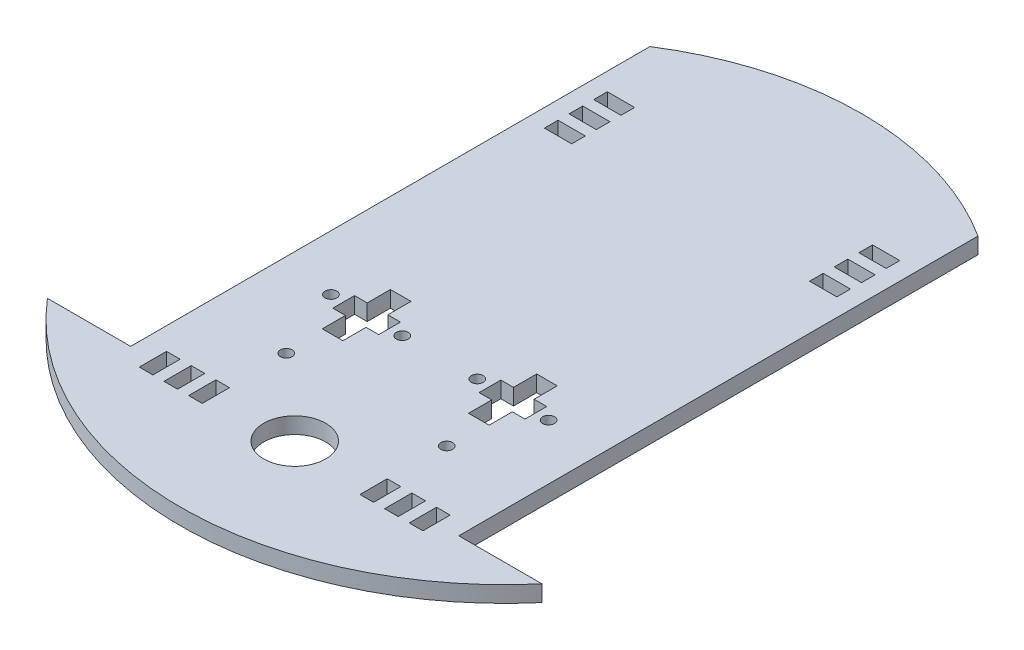
from build123d import *

# Parameters (mm, degrees)
CROQUIS3_R              = 9.54
CROQUIS3_R_2            = 1.825
CROQUIS3_W              = 8.4
CROQUIS3_H              = 4.2
CROQUIS3_W_2            = 4.2
CROQUIS3_H_2            = 8.4
SALIENTE_EXTRUIR1_DEPTH = 5


with BuildPart() as part:
    # Croquis3 → Saliente-Extruir1 (new body)
    with BuildSketch(Plane(origin=(0, 0, 0), x_dir=(1, 0, 0), z_dir=(0, 1, 0))):
        with BuildLine():
            Line((50.5587, 0), (76.2, 0))
            ThreePointArc((76.2, 0), (0, -35.242297755), (-76.2, 0))
            Line((-76.2, 0), (-50.5587, 0))
            Line((-50.5587, 0), (-50.5587, 160))
            ThreePointArc((-50.5587, 160), (0, 174.754698219), (50.5587, 160))
            Line((50.5587, 160), (50.5587, 0))
        make_face()
        with Locations(Location((0, 0, 0), (0, 0, 270))):
            Circle(CROQUIS3_R, mode=Mode.SUBTRACT)
        with Locations(Location((33.5337, 44.7, 0), (0, 0, 270))):
            Circle(CROQUIS3_R_2, mode=Mode.SUBTRACT)
        with Locations(Location((11.5437, 44.7, 0), (0, 0, 90))):
            Circle(CROQUIS3_R_2, mode=Mode.SUBTRACT)
        with Locations(Location((-33.5337, 44.7, 0), (0, 0, 90))):
            Circle(CROQUIS3_R_2, mode=Mode.SUBTRACT)
        with Locations(Location((-11.5437, 44.7, 0), (0, 0, 270))):
            Circle(CROQUIS3_R_2, mode=Mode.SUBTRACT)
        with Locations(Location((24.7337, 22.125, 0), (0, 0, 270))):
            Circle(CROQUIS3_R_2, mode=Mode.SUBTRACT)
        with Locations(Location((-24.7337, 22.125, 0), (0, 0, 90))):
            Circle(CROQUIS3_R_2, mode=Mode.SUBTRACT)
        with Locations((40.8587, 131.7)):
            Rectangle(CROQUIS3_W, CROQUIS3_H, mode=Mode.SUBTRACT)
        with Locations((40.8587, 124.1)):
            Rectangle(CROQUIS3_W, CROQUIS3_H, mode=Mode.SUBTRACT)
        with Locations((40.8587, 139.3)):
            Rectangle(CROQUIS3_W, CROQUIS3_H, mode=Mode.SUBTRACT)
        with Locations((-40.8587, 124.1)):
            Rectangle(CROQUIS3_W, CROQUIS3_H, mode=Mode.SUBTRACT)
        with Locations((-40.8587, 131.7)):
            Rectangle(CROQUIS3_W, CROQUIS3_H, mode=Mode.SUBTRACT)
        with Locations((-40.8587, 139.3)):
            Rectangle(CROQUIS3_W, CROQUIS3_H, mode=Mode.SUBTRACT)
        with Locations((33.9987, 0)):
            Rectangle(CROQUIS3_W_2, CROQUIS3_H_2, mode=Mode.SUBTRACT)
        with Locations((41.5987, 0)):
            Rectangle(CROQUIS3_W_2, CROQUIS3_H_2, mode=Mode.SUBTRACT)
        with Locations((26.3987, 0)):
            Rectangle(CROQUIS3_W_2, CROQUIS3_H_2, mode=Mode.SUBTRACT)
        with Locations((-41.5987, 0)):
            Rectangle(CROQUIS3_W_2, CROQUIS3_H_2, mode=Mode.SUBTRACT)
        with Locations((-33.9987, 0)):
            Rectangle(CROQUIS3_W_2, CROQUIS3_H_2, mode=Mode.SUBTRACT)
        with Locations((-26.3987, 0)):
            Rectangle(CROQUIS3_W_2, CROQUIS3_H_2, mode=Mode.SUBTRACT)
        Polygon((19.3637, 34.2), (19.3637, 41.35), (15.4687, 41.35), (15.4687, 48.05), (19.3637, 48.05), (19.3637, 55.2), (25.7137, 55.2), (25.7137, 48.05), (29.6087, 48.05), (29.6087, 41.35), (25.7137, 41.35), (25.7137, 34.2), align=None, mode=Mode.SUBTRACT)
        Polygon((-19.3637, 34.2), (-19.3637, 41.35), (-15.4687, 41.35), (-15.4687, 48.05), (-19.3637, 48.05), (-19.3637, 55.2), (-25.7137, 55.2), (-25.7137, 48.05), (-29.6087, 48.05), (-29.6087, 41.35), (-25.7137, 41.35), (-25.7137, 34.2), align=None, mode=Mode.SUBTRACT)
    extrude(amount=SALIENTE_EXTRUIR1_DEPTH)


solid = part.part
